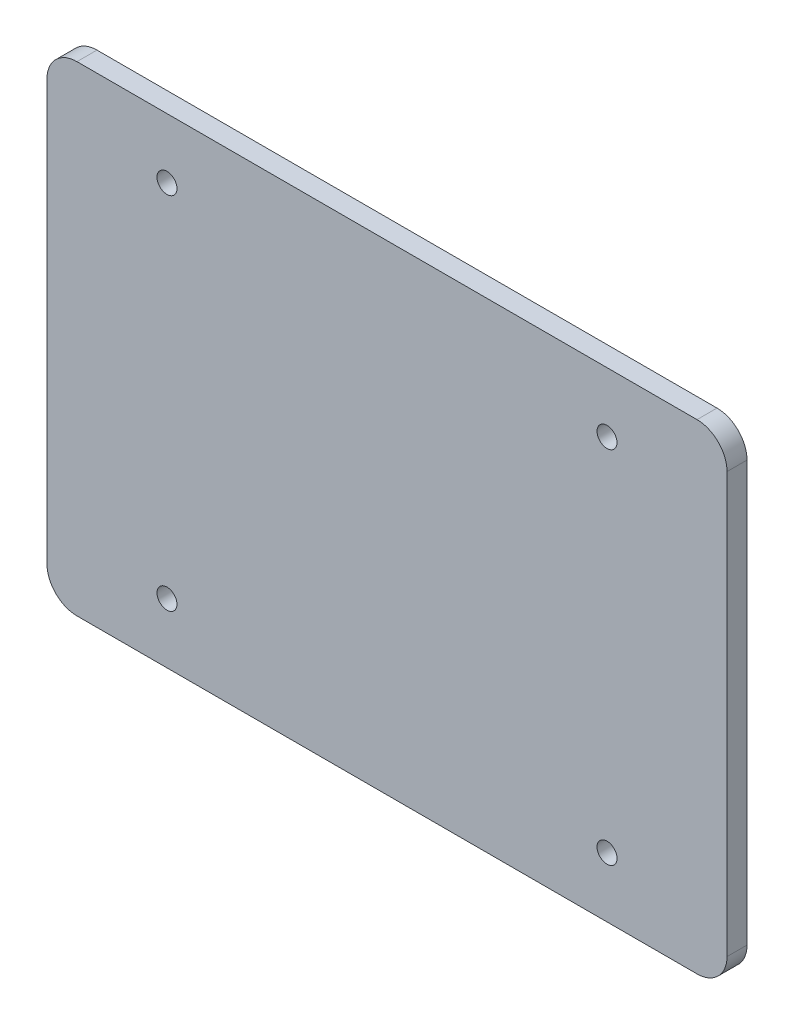
from build123d import *

# Parameters (mm, degrees)
SKETCH_1_W          = 340
SKETCH_1_H          = 240
EXTRUDE_1_DEPTH     = 10
FILLET_1_R          = 15
FILLET_2_R          = 15
FILLET_3_R          = 15
FILLET_4_R          = 15
SKETCH_2_R          = 5
CUT_EXTRUDE_1_DEPTH = 10


with BuildPart() as part:
    # 草图1 → 凸台-拉伸1 (new body)
    with BuildSketch(Plane.XY):
        Rectangle(SKETCH_1_W, SKETCH_1_H)
    extrude(amount=EXTRUDE_1_DEPTH)

    # 圆角1
    fillet_1_edges = [part.edges().sort_by_distance(p)[0] for p in [
        (-170, 120, 5),
    ]]
    fillet(fillet_1_edges, radius=FILLET_1_R)

    # 圆角2
    fillet_2_edges = [part.edges().sort_by_distance(p)[0] for p in [
        (170, 120, 5),
    ]]
    fillet(fillet_2_edges, radius=FILLET_2_R)

    # 圆角3
    fillet_3_edges = [part.edges().sort_by_distance(p)[0] for p in [
        (170, -120, 5),
    ]]
    fillet(fillet_3_edges, radius=FILLET_3_R)

    # 圆角4
    fillet_4_edges = [part.edges().sort_by_distance(p)[0] for p in [
        (-170, -120, 5),
    ]]
    fillet(fillet_4_edges, radius=FILLET_4_R)

    # 草图2 → 切除-拉伸1 (cut)
    with BuildSketch(Plane.XY.offset(10)):
        with Locations((110, 90)):
            Circle(SKETCH_2_R)
        with Locations((-110, 90)):
            Circle(SKETCH_2_R)
        with Locations(Location((110, -90, 0), (0, 0, 180))):
            Circle(SKETCH_2_R)
        with Locations(Location((-110, -90, 0), (0, 0, 180))):
            Circle(SKETCH_2_R)
    extrude(amount=-CUT_EXTRUDE_1_DEPTH, mode=Mode.SUBTRACT)


solid = part.part
